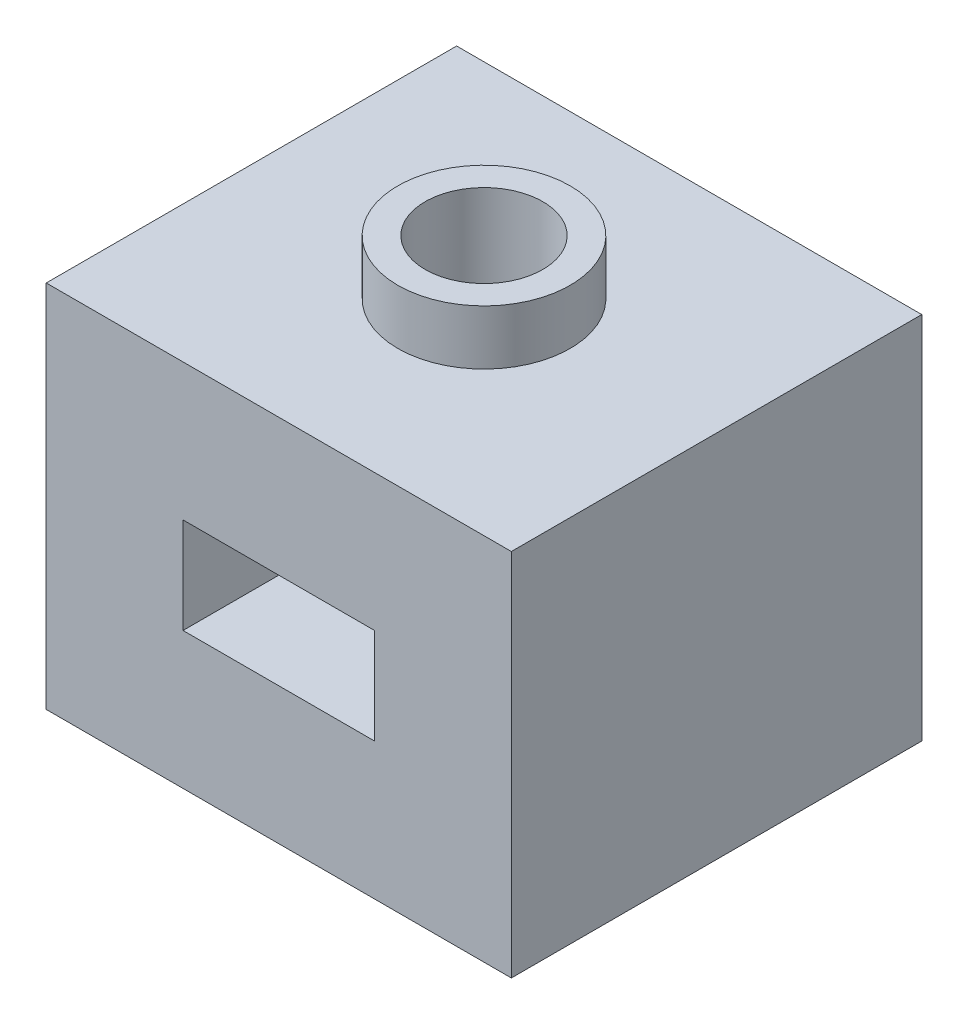
from build123d import *

# Parameters (mm, degrees)
SKETCH2_W           = 17
SKETCH2_H           = 13.5
SKETCH2_W_2         = 7
SKETCH2_H_2         = 3.5
BOSS_EXTRUDE1_DEPTH = 15
SKETCH3_R           = 2.15
CUT_EXTRUDE1_DEPTH  = 15
BOSS_EXTRUDE2_START = 2
SKETCH4_R           = 3.15
SKETCH4_R_2         = 2.15
BOSS_EXTRUDE2_DEPTH = 2


with BuildPart() as part:
    # Sketch2 → Boss-Extrude1 (new body)
    with BuildSketch(Plane.XY):
        Rectangle(SKETCH2_W, SKETCH2_H)
        Rectangle(SKETCH2_W_2, SKETCH2_H_2, mode=Mode.SUBTRACT)
    extrude(amount=BOSS_EXTRUDE1_DEPTH)

    # Sketch3 → Cut-Extrude1 (cut)
    with BuildSketch(Plane(origin=(0, 6.75, 0), x_dir=(1, 0, 0), z_dir=(0, 1, 0))):
        with Locations(Location((0, -7.5, 0), (0, 0, 270))):
            Circle(SKETCH3_R)
    extrude(amount=-CUT_EXTRUDE1_DEPTH, mode=Mode.SUBTRACT)

    # Sketch4 → Boss-Extrude2 (add)
    with BuildSketch(Plane(origin=(0, 6.75, 0), x_dir=(1, 0, 0), z_dir=(0, 1, 0)).offset(BOSS_EXTRUDE2_START)):
        with Locations(Location((0, -7.5, 0), (0, 0, 90))):
            Circle(SKETCH4_R)
        with Locations(Location((0, -7.5, 0), (0, 0, 270))):
            Circle(SKETCH4_R_2, mode=Mode.SUBTRACT)
    extrude(amount=-BOSS_EXTRUDE2_DEPTH)


solid = part.part
